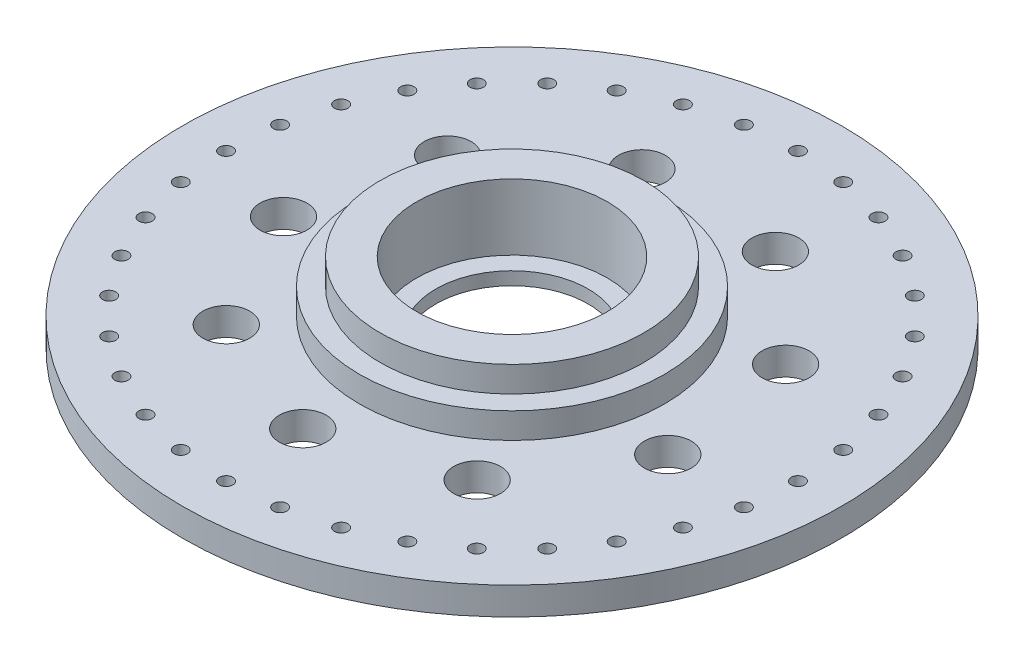
from build123d import *

# Parameters (mm, degrees)
SKETCH1_R           = 71.374
BOSS_EXTRUDE1_DEPTH = 5.9944
SKETCH2_R           = 28.575
SKETCH2_R_2         = 20.6502
BOSS_EXTRUDE2_DEPTH = 11.1252
CUT_EXTRUDE2_START  = -3.175
SKETCH3_R           = 20.6502
CUT_EXTRUDE2_DEPTH  = 3.175
SKETCH4_R           = 16.51
CUT_EXTRUDE3_DEPTH  = 102.946022345
SKETCH5_R           = 5.08
CUT_EXTRUDE4_DEPTH  = 102.549327063
SKETCH7_R           = 33.02
SKETCH7_R_2         = 28.575
BOSS_EXTRUDE3_DEPTH = 5.5626
SKETCH8_R           = 1.4478
CUT_EXTRUDE7_DEPTH  = 102.549327063
SKETCH9_R           = 5.08
CUT_EXTRUDE8_DEPTH  = 102.549327063


with BuildPart() as part:
    # Sketch1 → Boss-Extrude1 (new body)
    with BuildSketch(Plane(origin=(0, 0, 0), x_dir=(1, 0, 0), z_dir=(0, 1, 0))):
        with Locations(Location((0, 0, 0), (0, 0, 90))):
            Circle(SKETCH1_R)
    extrude(amount=BOSS_EXTRUDE1_DEPTH)

    # Sketch2 → Boss-Extrude2 (add)
    with BuildSketch(Plane(origin=(0, 5.9944, 0), x_dir=(1, 0, 0), z_dir=(0, 1, 0))):
        with Locations(Location((0, 0, 0), (0, 0, 90))):
            Circle(SKETCH2_R)
        with Locations(Location((0, 0, 0), (0, 0, 90))):
            Circle(SKETCH2_R_2, mode=Mode.SUBTRACT)
    extrude(amount=BOSS_EXTRUDE2_DEPTH)

    # Sketch3 → Cut-Extrude2 (cut)
    with BuildSketch(Plane(origin=(0, 5.9944, 0), x_dir=(1, 0, 0), z_dir=(0, 1, 0)).offset(CUT_EXTRUDE2_START)):
        with Locations(Location((0, 0, 0), (0, 0, 90))):
            Circle(SKETCH3_R)
    extrude(amount=CUT_EXTRUDE2_DEPTH, mode=Mode.SUBTRACT)

    # Sketch4 → Cut-Extrude3 (cut, through all)
    with BuildSketch(Plane(origin=(0, 2.8194, 0), x_dir=(1, 0, 0), z_dir=(0, 1, 0))):
        with Locations(Location((0, 0, 0), (0, 0, 270))):
            Circle(SKETCH4_R)
    extrude(amount=-CUT_EXTRUDE3_DEPTH, mode=Mode.SUBTRACT)

    # Sketch5 → Cut-Extrude4 (cut, through all)
    with BuildSketch(Plane(origin=(0, 5.9944, 0), x_dir=(1, 0, 0), z_dir=(0, 1, 0))):
        with Locations(Location((16.413387891, 40.624560588, 0), (0, 0, 270))):
            Circle(SKETCH5_R)
        with Locations(Location((26.975207541, -34.526691169, 0), (0, 0, 270))):
            Circle(SKETCH5_R)
        with Locations(Location((-1.529121448, -43.788309086, 0), (0, 0, 270))):
            Circle(SKETCH5_R)
        with Locations(Location((-29.317957518, -32.560890528, 0), (0, 0, 270))):
            Circle(SKETCH5_R)
        with Locations(Location((-43.388595432, -6.097869419, 0), (0, 0, 270))):
            Circle(SKETCH5_R)
        with Locations(Location((-37.157227333, 23.218412562, 0), (0, 0, 270))):
            Circle(SKETCH5_R)
        with Locations(Location((-13.539579609, 41.670541261, 0), (0, 0, 270))):
            Circle(SKETCH5_R)
    extrude(amount=-CUT_EXTRUDE4_DEPTH, mode=Mode.SUBTRACT)

    # Sketch7 → Boss-Extrude3 (add)
    with BuildSketch(Plane(origin=(0, 5.9944, 0), x_dir=(1, 0, 0), z_dir=(0, 1, 0))):
        with Locations(Location((0, 0, 0), (0, 0, 90))):
            Circle(SKETCH7_R)
        with Locations(Location((0, 0, 0), (0, 0, 90))):
            Circle(SKETCH7_R_2, mode=Mode.SUBTRACT)
    extrude(amount=BOSS_EXTRUDE3_DEPTH)

    # Sketch8 → Cut-Extrude7 (cut, through all)
    with BuildSketch(Plane(origin=(0, 5.9944, 0), x_dir=(1, 0, 0), z_dir=(0, 1, 0))):
        with Locations(Location((-53.628796334, 30.9626, 0), (0, 0, 270))):
            Circle(SKETCH8_R)
        with Locations(Location((-47.437455349, 39.804751287, 0), (0, 0, 270))):
            Circle(SKETCH8_R)
        with Locations(Location((-39.804751287, 47.437455349, 0), (0, 0, 270))):
            Circle(SKETCH8_R)
        with Locations(Location((-30.9626, 53.628796334, 0), (0, 0, 270))):
            Circle(SKETCH8_R)
        with Locations(Location((-21.179665779, 58.190653481, 0), (0, 0, 270))):
            Circle(SKETCH8_R)
        with Locations(Location((-10.753198132, 60.984417067, 0), (0, 0, 270))):
            Circle(SKETCH8_R)
        with Locations(Location((0, 61.9252, 0), (0, 0, 270))):
            Circle(SKETCH8_R)
        with Locations(Location((10.753198132, 60.984417067, 0), (0, 0, 270))):
            Circle(SKETCH8_R)
        with Locations(Location((21.179665779, 58.190653481, 0), (0, 0, 270))):
            Circle(SKETCH8_R)
        with Locations(Location((30.9626, 53.628796334, 0), (0, 0, 270))):
            Circle(SKETCH8_R)
        with Locations(Location((39.804751287, 47.437455349, 0), (0, 0, 270))):
            Circle(SKETCH8_R)
        with Locations(Location((47.437455349, 39.804751287, 0), (0, 0, 270))):
            Circle(SKETCH8_R)
        with Locations(Location((53.628796334, 30.9626, 0), (0, 0, 270))):
            Circle(SKETCH8_R)
        with Locations(Location((58.190653481, 21.179665779, 0), (0, 0, 270))):
            Circle(SKETCH8_R)
        with Locations(Location((60.984417067, 10.753198132, 0), (0, 0, 270))):
            Circle(SKETCH8_R)
        with Locations(Location((61.9252, 0, 0), (0, 0, 270))):
            Circle(SKETCH8_R)
        with Locations(Location((60.984417067, -10.753198132, 0), (0, 0, 270))):
            Circle(SKETCH8_R)
        with Locations(Location((58.190653481, -21.179665779, 0), (0, 0, 270))):
            Circle(SKETCH8_R)
        with Locations(Location((53.628796334, -30.9626, 0), (0, 0, 270))):
            Circle(SKETCH8_R)
        with Locations(Location((47.437455349, -39.804751287, 0), (0, 0, 270))):
            Circle(SKETCH8_R)
        with Locations(Location((39.804751287, -47.437455349, 0), (0, 0, 270))):
            Circle(SKETCH8_R)
        with Locations(Location((30.9626, -53.628796334, 0), (0, 0, 270))):
            Circle(SKETCH8_R)
        with Locations(Location((21.179665779, -58.190653481, 0), (0, 0, 270))):
            Circle(SKETCH8_R)
        with Locations(Location((10.753198132, -60.984417067, 0), (0, 0, 270))):
            Circle(SKETCH8_R)
        with Locations(Location((0, -61.9252, 0), (0, 0, 270))):
            Circle(SKETCH8_R)
        with Locations(Location((-10.753198132, -60.984417067, 0), (0, 0, 270))):
            Circle(SKETCH8_R)
        with Locations(Location((-21.179665779, -58.190653481, 0), (0, 0, 270))):
            Circle(SKETCH8_R)
        with Locations(Location((-30.9626, -53.628796334, 0), (0, 0, 270))):
            Circle(SKETCH8_R)
        with Locations(Location((-39.804751287, -47.437455349, 0), (0, 0, 270))):
            Circle(SKETCH8_R)
        with Locations(Location((-47.437455349, -39.804751287, 0), (0, 0, 270))):
            Circle(SKETCH8_R)
        with Locations(Location((-53.628796334, -30.9626, 0), (0, 0, 270))):
            Circle(SKETCH8_R)
        with Locations(Location((-58.190653481, -21.179665779, 0), (0, 0, 270))):
            Circle(SKETCH8_R)
        with Locations(Location((-60.984417067, -10.753198132, 0), (0, 0, 270))):
            Circle(SKETCH8_R)
        with Locations(Location((-61.9252, 0, 0), (0, 0, 270))):
            Circle(SKETCH8_R)
        with Locations(Location((-60.984417067, 10.753198132, 0), (0, 0, 270))):
            Circle(SKETCH8_R)
        with Locations(Location((-58.190653481, 21.179665779, 0), (0, 0, 270))):
            Circle(SKETCH8_R)
    extrude(amount=-CUT_EXTRUDE7_DEPTH, mode=Mode.SUBTRACT)

    # Sketch9 → Cut-Extrude8 (cut, through all)
    with BuildSketch(Plane(origin=(0, 5.9944, 0), x_dir=(1, 0, 0), z_dir=(0, 1, 0))):
        with Locations(Location((38.686348781, 20.569896523, 0), (0, 0, 270))):
            Circle(SKETCH9_R)
        with Locations(Location((42.857537126, -9.109650733, 0), (0, 0, 270))):
            Circle(SKETCH9_R)
    extrude(amount=-CUT_EXTRUDE8_DEPTH, mode=Mode.SUBTRACT)


solid = part.part
